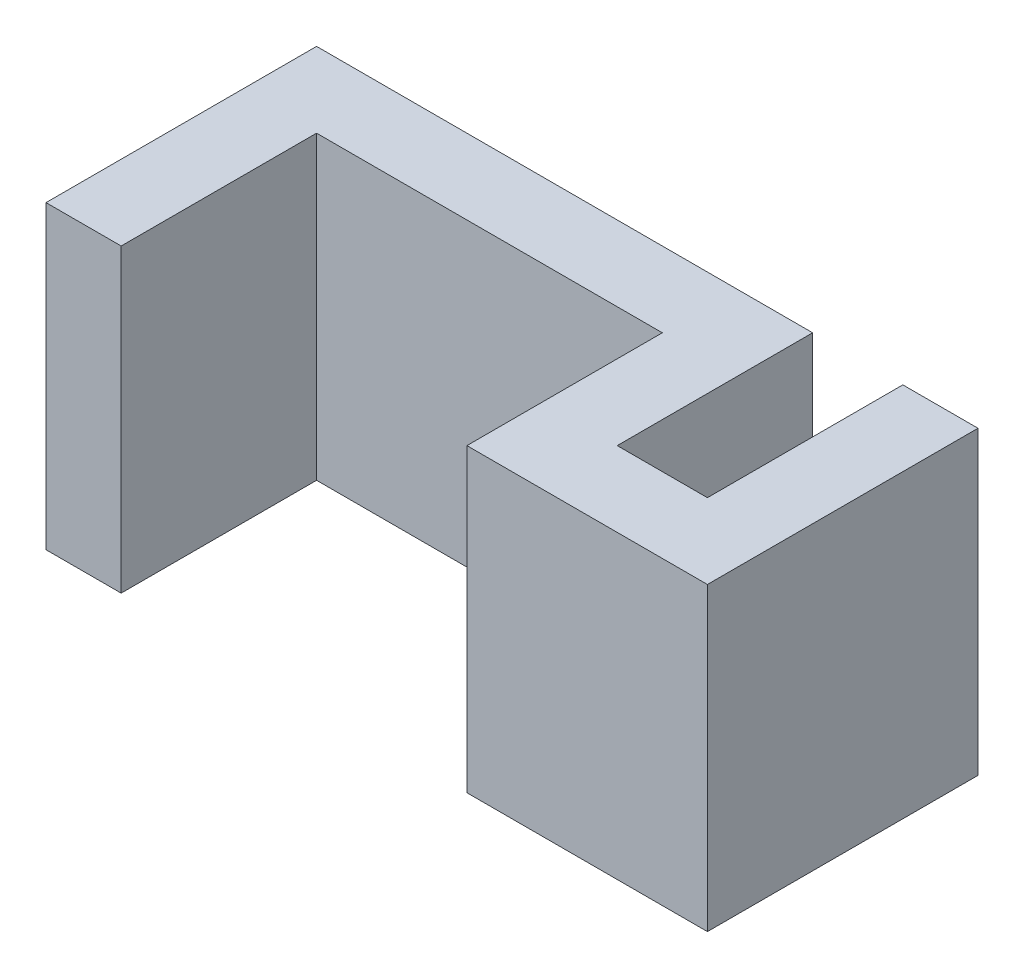
from build123d import *

# Parameters (mm, degrees)
BOSS_EXTRUDE1_DEPTH = 50.8


with BuildPart() as part:
    # Sketch1 → Boss-Extrude1 (new body)
    with BuildSketch(Plane(origin=(0, 0, 0), x_dir=(1, 0, 0), z_dir=(0, 1, 0))):
        Polygon((0, 0), (0, 33.02), (58.42, 33.02), (58.42, 0), (99.06, 0), (99.06, 45.72), (86.36, 45.72), (86.36, 12.7), (71.12, 12.7), (71.12, 45.72), (-12.7, 45.72), (-12.7, 0), align=None)
    extrude(amount=BOSS_EXTRUDE1_DEPTH)


solid = part.part
